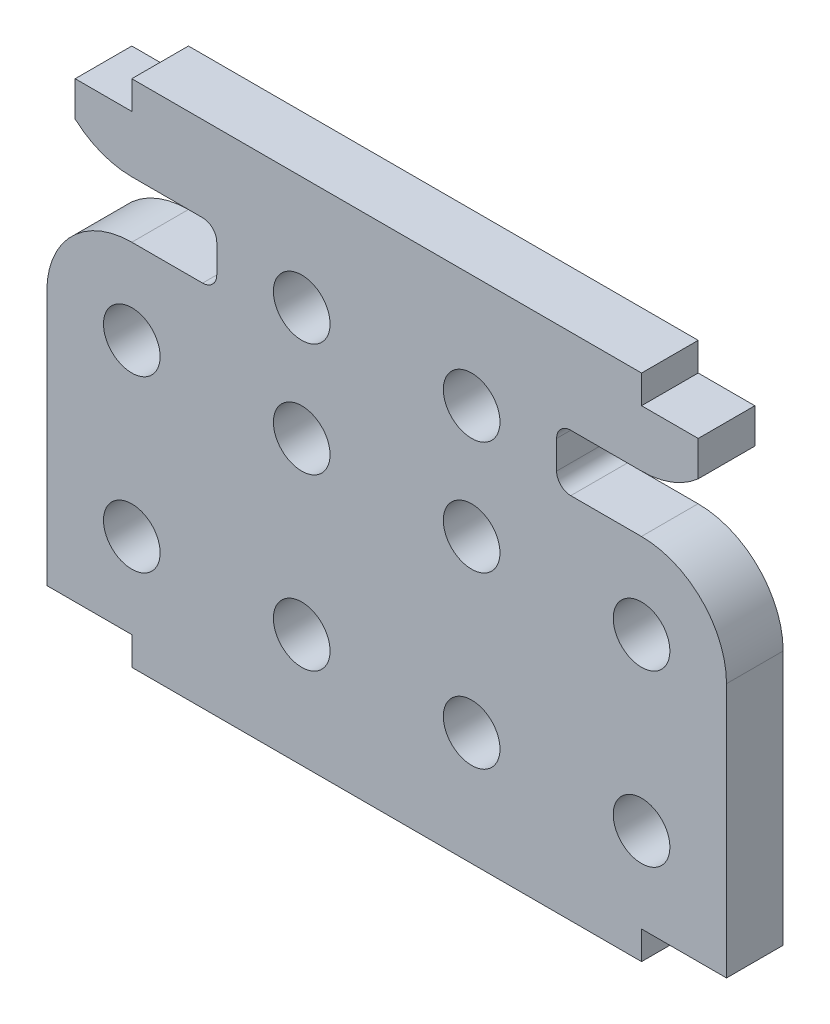
from build123d import *

# Parameters (mm, degrees)
MODEL_R                 = 1.5
SALIENTE_EXTRUIR1_DEPTH = 3


with BuildPart() as part:
    # Model → Saliente-Extruir1 (new body)
    with BuildSketch(Plane.XY):
        with BuildLine():
            ThreePointArc((110.375172306, 199.089330986), (107.193819506, 197.771939094), (105.875172656, 194.59110626))
            Line((105.875172656, 194.59110626), (105.875172656, 181.089330986))
            Line((105.875172656, 181.089330986), (110.375172306, 181.089330986))
            Line((110.375172306, 181.089330986), (110.375172306, 179.589330986))
            Line((110.375172306, 179.589330986), (137.375172656, 179.589330986))
            Line((137.375172656, 179.589330986), (137.375172656, 181.089330986))
            Line((137.375172656, 181.089330986), (141.875172656, 181.089330986))
            Line((141.875172656, 181.089330986), (141.875172656, 194.589330986))
            ThreePointArc((141.875172656, 194.589330986), (140.554536568, 197.773926028), (137.367774797, 199.089325081))
            Line((137.367774797, 199.089325081), (133.625176703, 199.089319857))
            ThreePointArc((133.625176703, 199.089319857), (133.09484632, 199.308989056), (132.875175691, 199.839318846))
            Line((132.875175691, 199.839318846), (132.875173667, 201.339318846))
            ThreePointArc((132.875173667, 201.339318846), (133.094842866, 201.869649228), (133.625172656, 202.089319857))
            Line((133.625172656, 202.089319857), (137.375178726, 202.089324916))
            ThreePointArc((137.375178726, 202.089324916), (138.980875531, 202.385553219), (140.375172656, 203.23522902))
            Line((140.375172656, 203.23522902), (140.375172656, 205.089330986))
            Line((140.375172656, 205.089330986), (137.375172656, 205.089330986))
            Line((137.375172656, 205.089330986), (137.375165869, 206.589324916))
            Line((137.375165869, 206.589324916), (110.375172306, 206.589330986))
            Line((110.375172306, 206.589330986), (110.375172306, 205.089330986))
            Line((110.375172306, 205.089330986), (107.375172306, 205.089330986))
            Line((107.375172306, 205.089330986), (107.375172306, 203.23522902))
            ThreePointArc((107.375172306, 203.23522902), (108.769472902, 202.385555371), (110.375172306, 202.089330986))
            Line((110.375172306, 202.089330986), (114.125172656, 202.089330986))
            ThreePointArc((114.125172656, 202.089330986), (114.655502742, 201.869661072), (114.875172656, 201.339330986))
            Line((114.875172656, 201.339330986), (114.875172656, 199.839330986))
            ThreePointArc((114.875172656, 199.839330986), (114.655502742, 199.3090009), (114.125172656, 199.089330986))
            Line((114.125172656, 199.089330986), (110.375172306, 199.089330986))
        make_face()
        with Locations((110.375172306, 185.589330986)):
            Circle(MODEL_R, mode=Mode.SUBTRACT)
        with Locations((119.375172306, 185.589330986)):
            Circle(MODEL_R, mode=Mode.SUBTRACT)
        with Locations((128.375172306, 185.589330986)):
            Circle(MODEL_R, mode=Mode.SUBTRACT)
        with Locations((137.375172306, 185.589330986)):
            Circle(MODEL_R, mode=Mode.SUBTRACT)
        with Locations((110.375172306, 194.589330986)):
            Circle(MODEL_R, mode=Mode.SUBTRACT)
        with Locations((119.375172306, 194.589330986)):
            Circle(MODEL_R, mode=Mode.SUBTRACT)
        with Locations((119.375172656, 200.589330986)):
            Circle(MODEL_R, mode=Mode.SUBTRACT)
        with Locations((128.375172306, 194.589330986)):
            Circle(MODEL_R, mode=Mode.SUBTRACT)
        with Locations((137.375172481, 194.589330986)):
            Circle(MODEL_R, mode=Mode.SUBTRACT)
        with Locations((128.375172656, 200.589330986)):
            Circle(MODEL_R, mode=Mode.SUBTRACT)
    extrude(amount=SALIENTE_EXTRUIR1_DEPTH)


solid = part.part
